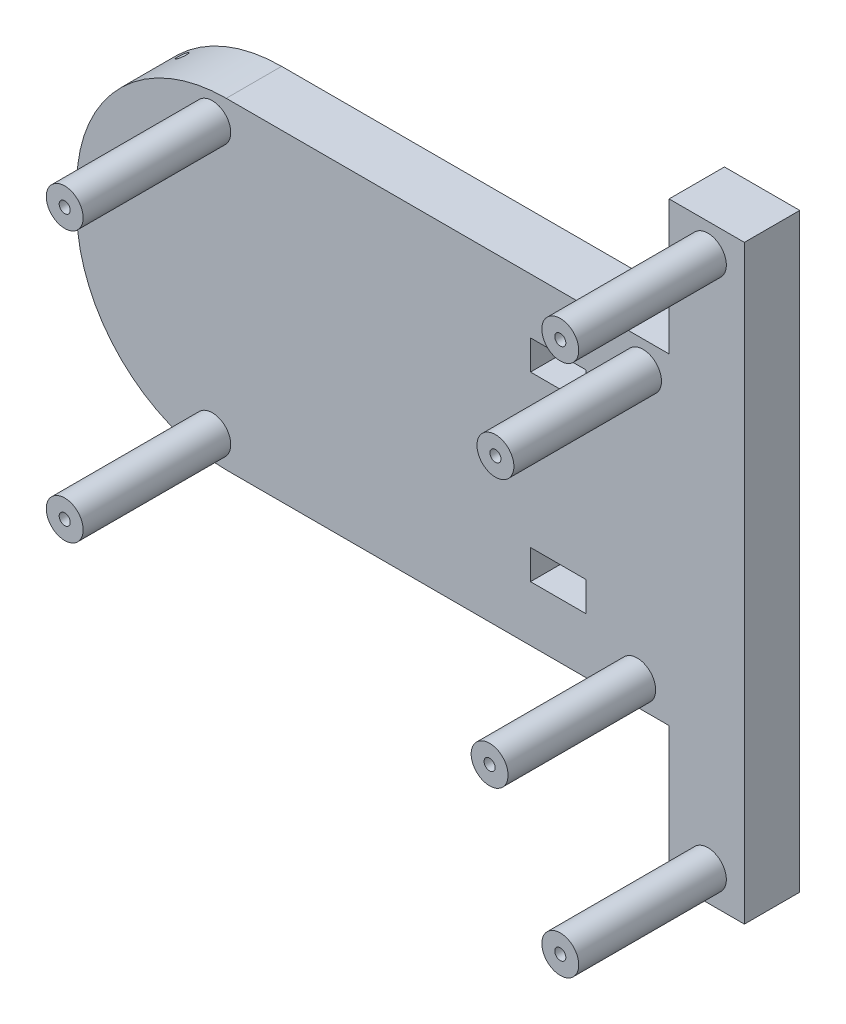
from build123d import *

# Parameters (mm, degrees)
ESQUISSE1_W             = 15.04863884
ESQUISSE1_H             = 8.025940715
BOSS_EXTRU_2_DEPTH      = 15
ESQUISSE2_R             = 1.5
ENL_V_MAT_EXTRU_1_DEPTH = 22
ESQUISSE7_R             = 1.5
ENL_V_MAT_EXTRU_2_DEPTH = 22
ESQUISSE8_R             = 5
ESQUISSE8_R_2           = 1.5
BOSS_EXTRU_3_DEPTH      = 40


with BuildPart() as part:
    # Esquisse1 → Boss.-Extru.2 (new body)
    with BuildSketch(Plane.XY):
        with BuildLine():
            Line((-20.404811956, 60.852158428), (-20.404811956, 43.608028339))
            Line((-20.404811956, 43.608028339), (-140.404811956, 43.608028339))
            ThreePointArc((-140.404811956, 43.608028339), (-170.122450923, 30.625328971), (-180.789117416, 0))
            ThreePointArc((-180.789117416, 0), (-170.122450923, -30.625328971), (-140.404811956, -43.608028339))
            Line((-140.404811956, -43.608028339), (-20.404811956, -43.608028339))
            Line((-20.404811956, -43.608028339), (-20.404811956, -60.852158428))
            Line((-20.404811956, -60.852158428), (-20.404811956, -80))
            Line((-20.404811956, -80), (0, -80))
            Line((0, -80), (0, 80))
            Line((0, 80), (-20.404811956, 80))
            Line((-20.404811956, 80), (-20.404811956, 60.852158428))
        make_face()
        with Locations((-50.437129359, 24.595057981)):
            Rectangle(ESQUISSE1_W, ESQUISSE1_H, mode=Mode.SUBTRACT)
        with Locations((-50.437129359, -24.595057981)):
            Rectangle(ESQUISSE1_W, ESQUISSE1_H, mode=Mode.SUBTRACT)
    extrude(amount=BOSS_EXTRU_2_DEPTH)

    # Esquisse2 → Enlèv. mat.-Extru.1 (cut)
    with BuildSketch(Plane(origin=(-170.122450923, 30.625328971, 0), x_dir=(0, 0, 1), z_dir=(-0.7337061397658711, 0.6794669237496878, 0))):
        with Locations(Location((3.566685756, 8.282361033, 0), (0, 0, 270))):
            Circle(ESQUISSE2_R)
        with Locations(Location((3.566685756, -21.717638967, 0), (0, 0, 270))):
            Circle(ESQUISSE2_R)
        with Locations(Location((3.566685756, -6.717638967, 0), (0, 0, 270))):
            Circle(ESQUISSE2_R)
    extrude(amount=-ENL_V_MAT_EXTRU_1_DEPTH, mode=Mode.SUBTRACT)

    # Esquisse7 → Enlèv. mat.-Extru.2 (cut)
    with BuildSketch(Plane(origin=(-170.122450923, -30.625328971, 15), x_dir=(0, 0, 1), z_dir=(-0.7337061397658707, -0.6794669237496883, 0))):
        with Locations(Location((-11.555586861, 21.717638967, 0), (0, 0, 270))):
            Circle(ESQUISSE7_R)
        with Locations(Location((-11.555586861, -8.282361033, 0), (0, 0, 270))):
            Circle(ESQUISSE7_R)
        with Locations(Location((-11.555586861, 6.717638967, 0), (0, 0, 270))):
            Circle(ESQUISSE7_R)
    extrude(amount=-ENL_V_MAT_EXTRU_2_DEPTH, mode=Mode.SUBTRACT)

    # Esquisse8 → Boss.-Extru.3 (add)
    # profile 1 of 6: a face of its own
    with BuildSketch(Plane.XY.offset(15)):
        with Locations(Location((-9.890580264, 72.213588888, 0), (0, 0, 180))):
            Circle(ESQUISSE8_R)
        with Locations((-9.890580264, 72.213588888)):
            Circle(ESQUISSE8_R_2, mode=Mode.SUBTRACT)
    # profile 2 of 6: a face of its own
    with BuildSketch(Plane.XY.offset(15)):
        with Locations(Location((-9.890580264, -71.991912234, 0), (0, 0, 180))):
            Circle(ESQUISSE8_R)
        with Locations((-9.890580264, -71.991912234)):
            Circle(ESQUISSE8_R_2, mode=Mode.SUBTRACT)
    # profile 3 of 6: a face of its own
    with BuildSketch(Plane.XY.offset(15)):
        with Locations(Location((-27.465625713, 36.162213608, 0), (0, 0, 180))):
            Circle(ESQUISSE8_R)
        with Locations((-27.465625713, 36.162213608)):
            Circle(ESQUISSE8_R_2, mode=Mode.SUBTRACT)
    # profile 4 of 6: a face of its own
    with BuildSketch(Plane.XY.offset(15)):
        with Locations(Location((-29.042873382, -37.067142431, 0), (0, 0, 180))):
            Circle(ESQUISSE8_R)
        with Locations((-29.042873382, -37.067142431)):
            Circle(ESQUISSE8_R_2, mode=Mode.SUBTRACT)
    # profile 5 of 6: a face of its own
    with BuildSketch(Plane.XY.offset(15)):
        with Locations(Location((-144.181953183, 36.162213608, 0), (0, 0, 180))):
            Circle(ESQUISSE8_R)
        with Locations((-144.181953183, 36.162213608)):
            Circle(ESQUISSE8_R_2, mode=Mode.SUBTRACT)
    # profile 6 of 6: a face of its own
    with BuildSketch(Plane.XY.offset(15)):
        with Locations(Location((-144.181953183, -37.067142431, 0), (0, 0, 180))):
            Circle(ESQUISSE8_R)
        with Locations((-144.181953183, -37.067142431)):
            Circle(ESQUISSE8_R_2, mode=Mode.SUBTRACT)
    extrude(amount=BOSS_EXTRU_3_DEPTH)


solid = part.part
